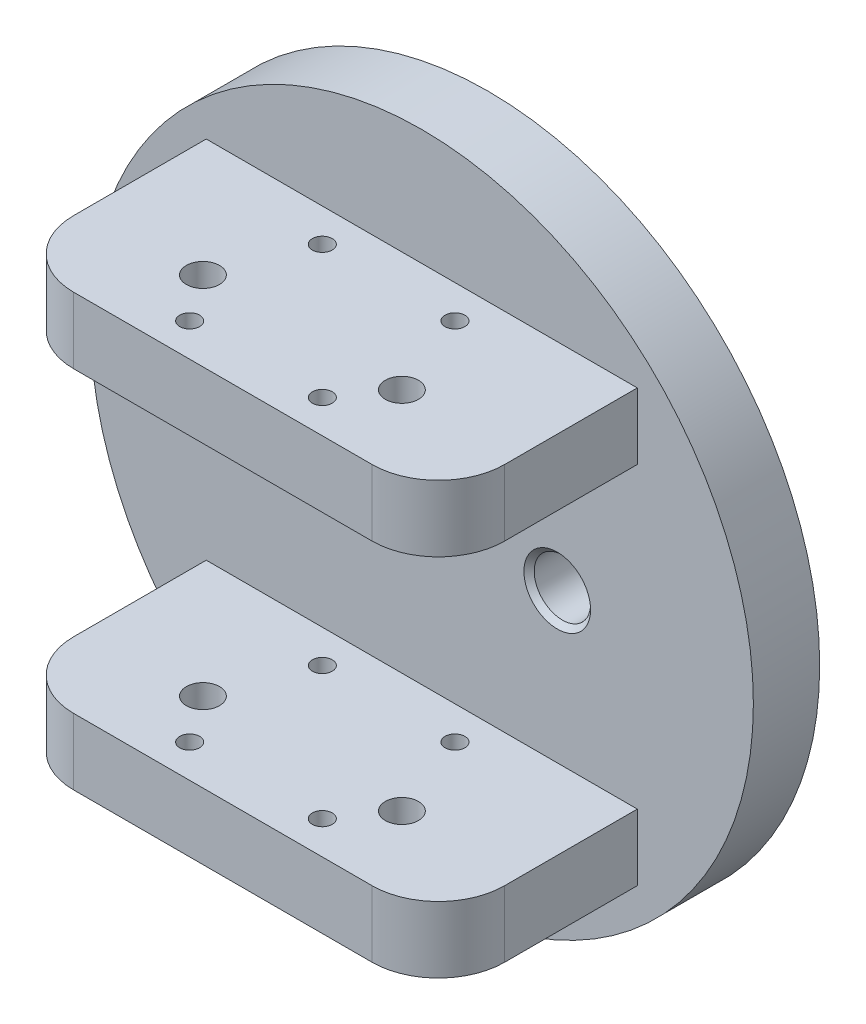
from build123d import *

# Parameters (mm, degrees)
SKETCH_1_R                    = 50
EXTRUDE_1_DEPTH               = 10
HOLE_WIZARD_M10_1_D           = 8.5
HOLE_WIZARD_M10_1_CSINK_D     = 10.05
HOLE_WIZARD_M10_1_CSINK_ANGLE = 90
SKETCH_9_W                    = 65
SKETCH_9_H                    = 10
EXTRUDE_3_DEPTH               = 30
FILLET_2_R                    = 10
SKETCH_14_R                   = 2.5
SKETCH_14_R_2                 = 1.5
CUT_EXTRUDE_3_DEPTH           = 105.432992871


with BuildPart() as part:
    # 草图1 → 凸台-拉伸1 (new body)
    with BuildSketch(Plane.XY):
        Circle(SKETCH_1_R)
    extrude(amount=EXTRUDE_1_DEPTH)

    # M10 螺纹孔1 (through all)
    with Locations(Plane.XY.offset(10)):
        with Locations((-20.426671729, 0)):
            hole_wizard_m10_1 = CounterSinkHole(HOLE_WIZARD_M10_1_D / 2, HOLE_WIZARD_M10_1_CSINK_D / 2, counter_sink_angle=HOLE_WIZARD_M10_1_CSINK_ANGLE)

    # 镜向2: M10 螺纹孔1 across plane
    add(hole_wizard_m10_1.mirror(Plane(origin=(0, 0, 0), x_dir=(0, 0, 1), z_dir=(1, 0, 0))), mode=Mode.SUBTRACT)

    # 草图9 → 凸台-拉伸3 (add)
    with BuildSketch(Plane.XY.offset(10)):
        with Locations((0, 27.5)):
            Rectangle(SKETCH_9_W, SKETCH_9_H)
        with Locations((0, -27.5)):
            Rectangle(SKETCH_9_W, SKETCH_9_H)
    extrude(amount=EXTRUDE_3_DEPTH)

    # 圆角2
    fillet_2_edges = [part.edges().sort_by_distance(p)[0] for p in [
        (32.5, -27.5, 40),
        (-32.5, -27.5, 40),
        (-32.5, 27.5, 40),
        (32.5, 27.5, 40),
    ]]
    fillet(fillet_2_edges, radius=FILLET_2_R)

    # 草图14 → 切除-拉伸3 (cut, through all)
    with BuildSketch(Plane(origin=(0, 32.5, 0), x_dir=(1, 0, 0), z_dir=(0, 1, 0))):
        with Locations(Location((-15, -28, 0), (0, 0, 270))):
            Circle(SKETCH_14_R)
        with Locations(Location((10, -15, 0), (0, 0, 270))):
            Circle(SKETCH_14_R_2)
        with Locations(Location((15, -28, 0), (0, 0, 270))):
            Circle(SKETCH_14_R)
        with Locations(Location((10, -35, 0), (0, 0, 270))):
            Circle(SKETCH_14_R_2)
        with Locations(Location((-10, -15, 0), (0, 0, 270))):
            Circle(SKETCH_14_R_2)
        with Locations(Location((-10, -35, 0), (0, 0, 270))):
            Circle(SKETCH_14_R_2)
    extrude(amount=-CUT_EXTRUDE_3_DEPTH, mode=Mode.SUBTRACT)


solid = part.part
